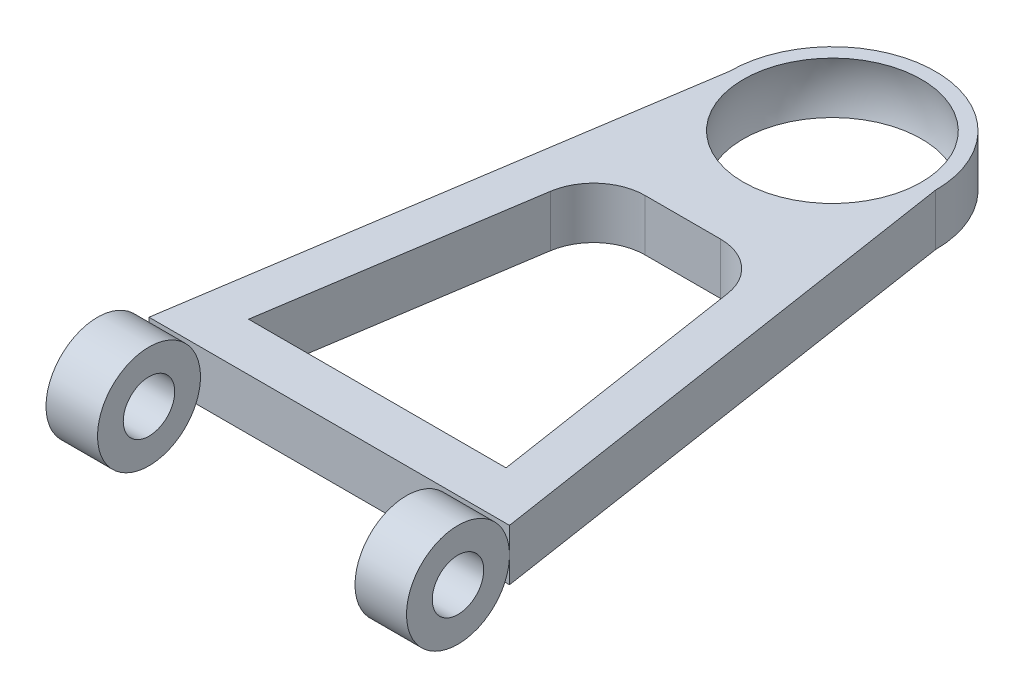
from build123d import *

# Parameters (mm, degrees)
BOSS_EXTRUDE1_DEPTH      = 5
BOSS_EXTRUDE1_DEPTH_BACK = 5
SKETCH3_W                = 10
SKETCH3_H                = 10
SKETCH5_R                = 5
CUT_EXTRUDE2_DEPTH       = 98
CUT_EXTRUDE4_DEPTH       = 98


with BuildPart() as part:
    # Sketch2 → Boss-Extrude1 (new, two sides: drawn at the far end of the back side and taken through both)
    with BuildSketch(Plane(origin=(0, 0, 0), x_dir=(1, 0, 0), z_dir=(0, 1, 0)).offset(-BOSS_EXTRUDE1_DEPTH_BACK)):
        with BuildLine():
            Line((-20, 97.7), (-35, 0))
            Line((-35, 0), (35, 0))
            Line((35, 0), (20, 97.7))
            ThreePointArc((20, 97.7), (0, 117.7), (-20, 97.7))
        make_face()
    extrude(amount=BOSS_EXTRUDE1_DEPTH + BOSS_EXTRUDE1_DEPTH_BACK)

    # Sketch7 → Cut-Extrude4 (cut)
    with BuildSketch(Plane(origin=(0, 5, 0), x_dir=(1, 0, 0), z_dir=(0, 1, 0))):
        with BuildLine():
            Line((0, 9.332317073), (25, 9.332317073))
            Line((25, 9.332317073), (17.197138653, 60.15495398))
            ThreePointArc((17.197138653, 60.15495398), (13.825430469, 66.226076116), (7.312954312, 68.637423119))
            Line((7.312954312, 68.637423119), (-7.312954312, 68.637423119))
            ThreePointArc((-7.312954312, 68.637423119), (-13.825430469, 66.226076116), (-17.197138653, 60.15495398))
            Line((-17.197138653, 60.15495398), (-25, 9.332317073))
            Line((-25, 9.332317073), (0, 9.332317073))
        make_face()
    extrude(amount=-CUT_EXTRUDE4_DEPTH, mode=Mode.SUBTRACT)

    # Sketch9 → Cut-Revolve1 (revolve, cut)
    with BuildSketch(Plane(origin=(0, 0, 0), x_dir=(1, 0, 0), z_dir=(0, 1, 0))):
        with BuildLine():
            Line((-18, 97.7), (18, 97.7))
            ThreePointArc((18, 97.7), (0, 115.7), (-18, 97.7))
        make_face()
    revolve(axis=Axis((-18, 0, -97.7), (1, 0, 0)), mode=Mode.SUBTRACT)


with BuildPart() as body_2:
    # Sketch3 → Revolve2 (revolve)
    with BuildSketch(Plane(origin=(0, 0, 0), x_dir=(1, 0, 0), z_dir=(0, 1, 0))):
        with Locations((-30, -5)):
            Rectangle(SKETCH3_W, SKETCH3_H)
        with Locations((30, -5)):
            Rectangle(SKETCH3_W, SKETCH3_H)
    revolve(axis=Axis((-35, 0, 10), (1, 0, 0)))

    # Sketch5 → Cut-Extrude2 (cut)
    with BuildSketch(Plane(origin=(35, 0, 0), x_dir=(0, 0, -1), z_dir=(1, 0, 0))):
        with Locations((-10, 0)):
            Circle(SKETCH5_R)
    extrude(amount=-CUT_EXTRUDE2_DEPTH, mode=Mode.SUBTRACT)


solid = Compound([part.part, body_2.part])
